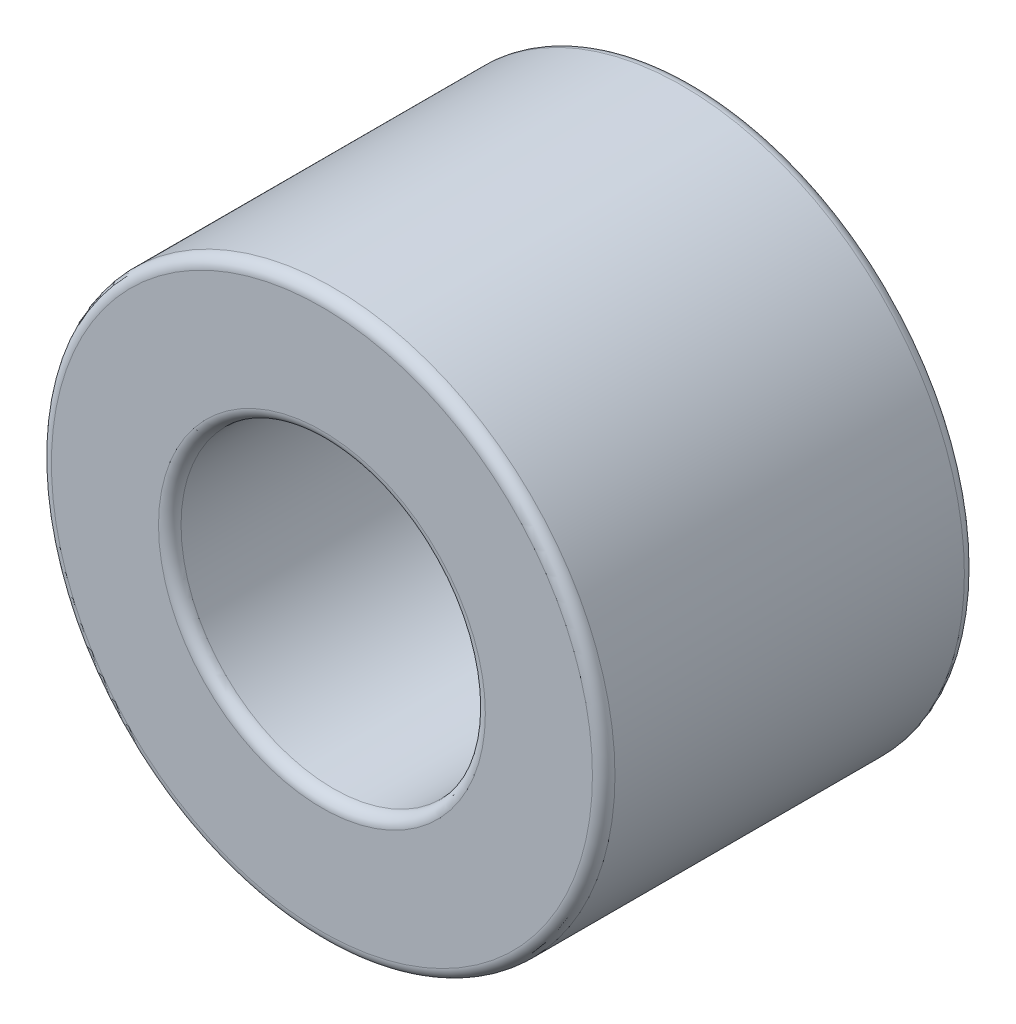
from build123d import *

# Parameters (mm, degrees)
SKETCH1_R           = 3.175
SKETCH1_R_2         = 1.7145
BOSS_EXTRUDE1_DEPTH = 4.191
FILLET1_R           = 0.127


with BuildPart() as part:
    # Sketch1 → Boss-Extrude1 (new body)
    with BuildSketch(Plane.XY):
        Circle(SKETCH1_R)
        Circle(SKETCH1_R_2, mode=Mode.SUBTRACT)
    extrude(amount=BOSS_EXTRUDE1_DEPTH)

    # Fillet1
    fillet1_edges = [part.edges().sort_by_distance(p)[0] for p in [
        (-3.175, 0, 0),
        (-3.175, 0, 4.191),
        (-1.7145, 0, 0),
        (-1.7145, 0, 4.191),
    ]]
    fillet(fillet1_edges, radius=FILLET1_R)


solid = part.part
